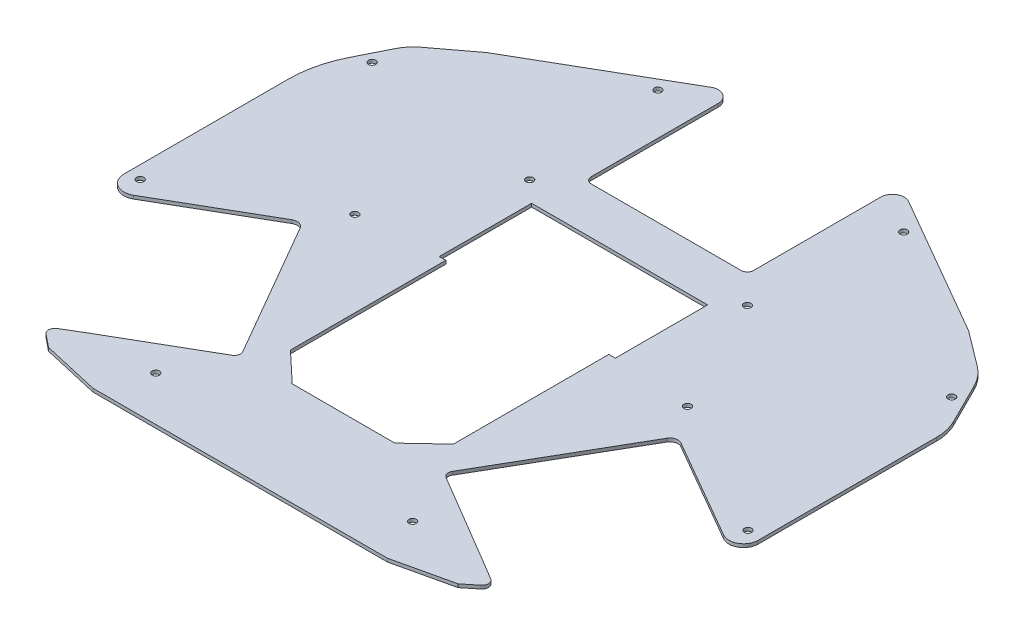
from build123d import *

# Parameters (mm, degrees)
SKETCH1_R           = 1.75
BOSS_EXTRUDE1_DEPTH = 1.6


with BuildPart() as part:
    # Sketch1 → Boss-Extrude1 (new body)
    with BuildSketch(Plane(origin=(0, 0, 0), x_dir=(1, 0, 0), z_dir=(0, 1, 0))):
        with BuildLine():
            Line((24.696313384, 21.403189927), (-19.414899465, 47.563680085))
            ThreePointArc((-19.414899465, 47.563680085), (-20.786874634, 49.384536896), (-20.482680557, 51.644028288))
            Line((-20.482680557, 51.644028288), (17.162414168, 116.847245007))
            ThreePointArc((17.162414168, 116.847245007), (19.546471274, 118.676596366), (22.525800971, 118.28436017))
            Line((22.525800971, 118.28436017), (70.987796177, 90.304814192))
            ThreePointArc((70.987796177, 90.304814192), (77.999004119, 90.304814192), (81.50460809, 96.376698381))
            Line((81.50460809, 96.376698381), (81.50460809, 182.02519482))
            ThreePointArc((81.50460809, 182.02519482), (80.873629228, 187.452491566), (79.01435205, 192.590270527))
            Line((79.01435205, 192.590270527), (69.144094326, 212.364639151))
            ThreePointArc((69.144094326, 212.364639151), (65.989183491, 217.196365343), (61.81193417, 221.177524531))
            Line((61.81193417, 221.177524531), (44.99314954, 233.854205885))
            Line((44.99314954, 233.854205885), (-23.199197227, 273.225075648))
            ThreePointArc((-23.199197227, 273.225075648), (-28.860512938, 273.225075648), (-31.691170793, 268.322232423))
            Line((-31.691170793, 268.322232423), (-31.691170793, 207.371759387))
            ThreePointArc((-31.691170793, 207.371759387), (-32.56985045, 205.250439044), (-34.691170793, 204.371759387))
            Line((-34.691170793, 204.371759387), (-106.595635326, 204.371759387))
            ThreePointArc((-106.595635326, 204.371759387), (-108.71695567, 205.250439044), (-109.595635326, 207.371759387))
            Line((-109.595635326, 207.371759387), (-109.595635326, 268.322232423))
            ThreePointArc((-109.595635326, 268.322232423), (-112.426293182, 273.225075648), (-118.087608892, 273.225075648))
            Line((-118.087608892, 273.225075648), (-186.279955659, 233.854205885))
            Line((-186.279955659, 233.854205885), (-204.21495553, 220.336208987))
            ThreePointArc((-204.21495553, 220.336208987), (-207.400637767, 217.300070339), (-209.806657286, 213.615266508))
            Line((-209.806657286, 213.615266508), (-217.247579174, 198.707901735))
            ThreePointArc((-217.247579174, 198.707901735), (-221.386722215, 187.270122423), (-222.791414209, 175.187815477))
            Line((-222.791414209, 175.187815477), (-222.791414209, 96.376698381))
            ThreePointArc((-222.791414209, 96.376698381), (-219.069332913, 89.929864467), (-211.625170321, 89.929864467))
            Line((-211.625170321, 89.929864467), (-163.512384372, 117.707794386))
            ThreePointArc((-163.512384372, 117.707794386), (-160.504762554, 118.10375531), (-158.098066116, 116.257032182))
            Line((-158.098066116, 116.257032182), (-120.496410943, 51.129054973))
            ThreePointArc((-120.496410943, 51.129054973), (-120.196709676, 48.852597838), (-121.594487155, 47.030978762))
            Line((-121.594487155, 47.030978762), (-165.983119503, 21.403189927))
            Line((-165.983119503, 21.403189927), (-174.676412504, 16.182853027))
            ThreePointArc((-174.676412504, 16.182853027), (-176.124776412, 13.818668342), (-175.016914475, 11.277060748))
            Line((-175.016914475, 11.277060748), (-168.860075369, 6.304549502))
            Line((-168.860075369, 6.304549502), (-141.286806119, 0))
            Line((-141.286806119, 0), (0, 0))
            Line((0, 0), (27.57326925, 6.304549502))
            Line((27.57326925, 6.304549502), (33.730108356, 11.277060748))
            ThreePointArc((33.730108356, 11.277060748), (34.837970293, 13.818668342), (33.389606385, 16.182853027))
            Line((33.389606385, 16.182853027), (24.696313384, 21.403189927))
        make_face()
        with Locations(Location((-123.091146174, 191.349343748, 0), (0, 0, 270))):
            Circle(SKETCH1_R, mode=Mode.SUBTRACT)
        with Locations(Location((-216.641081117, 98.036380822, 0), (0, 0, 270))):
            Circle(SKETCH1_R, mode=Mode.SUBTRACT)
        with Locations(Location((-18.645659945, 191.349343748, 0), (0, 0, 90))):
            Circle(SKETCH1_R, mode=Mode.SUBTRACT)
        with Locations(Location((74.914274997, 98.036380822, 0), (0, 0, 90))):
            Circle(SKETCH1_R, mode=Mode.SUBTRACT)
        with Locations(Location((-9.245725003, 21.35, 0), (0, 0, 270))):
            Circle(SKETCH1_R, mode=Mode.SUBTRACT)
        with Locations(Location((-132.441081117, 21.35, 0), (0, 0, 270))):
            Circle(SKETCH1_R, mode=Mode.SUBTRACT)
        with Locations(Location((-150.641414209, 135.049343748, 0), (0, 0, 270))):
            Circle(SKETCH1_R, mode=Mode.SUBTRACT)
        with Locations(Location((8.91460809, 135.049343748, 0), (0, 0, 270))):
            Circle(SKETCH1_R, mode=Mode.SUBTRACT)
        with Locations(Location((68.354340055, 202.349343748, 0), (0, 0, 270))):
            Circle(SKETCH1_R, mode=Mode.SUBTRACT)
        with Locations(Location((-11.691170793, 259.371759387, 0), (0, 0, 270))):
            Circle(SKETCH1_R, mode=Mode.SUBTRACT)
        with Locations(Location((-129.595635326, 259.371759387, 0), (0, 0, 270))):
            Circle(SKETCH1_R, mode=Mode.SUBTRACT)
        with Locations(Location((-209.641146174, 202.349343748, 0), (0, 0, 270))):
            Circle(SKETCH1_R, mode=Mode.SUBTRACT)
        Polygon((-31.555725003, 63.222149708), (-46.022445575, 49.606380822), (-95.264360544, 49.606380822), (-109.731081117, 63.222149708), (-109.731081117, 137.774232151), (-112.861146174, 137.774232151), (-112.861146174, 182.049343748), (-28.425659945, 182.049343748), (-28.425659945, 137.774232151), (-31.555725003, 137.774232151), align=None, mode=Mode.SUBTRACT)
    extrude(amount=BOSS_EXTRUDE1_DEPTH)


solid = part.part
